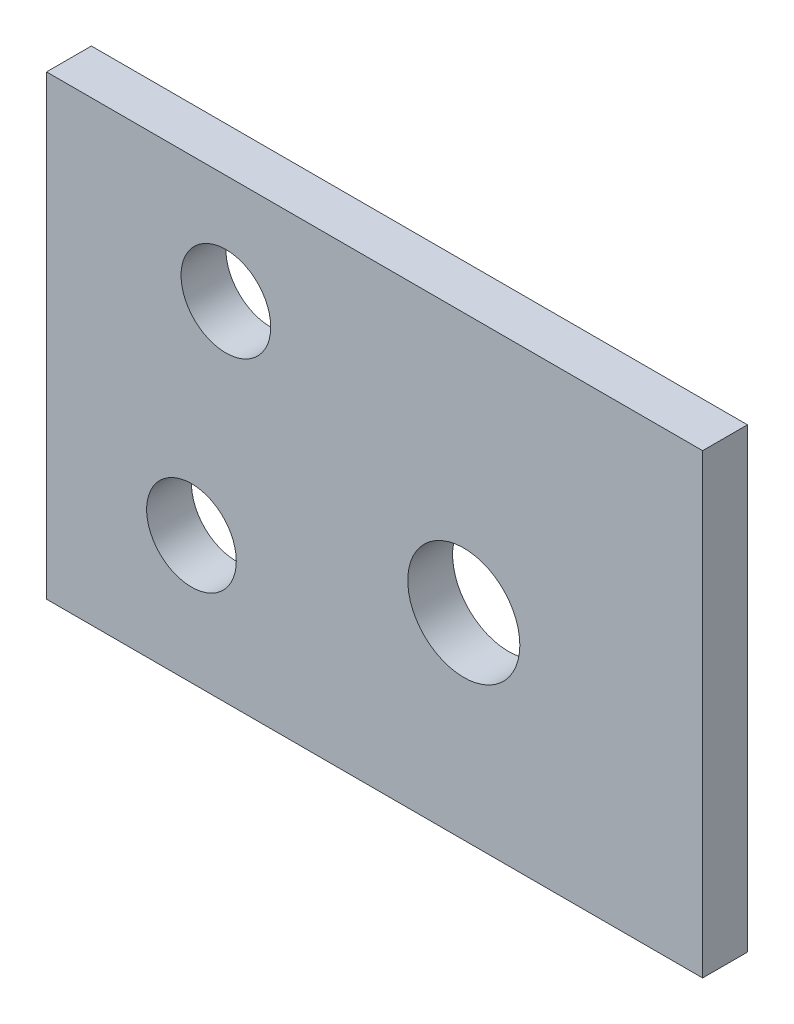
from build123d import *

# Parameters (mm, degrees)
SKETCH_1_W      = 29.26762047
SKETCH_1_H      = 20.372942069
SKETCH_1_R      = 2
SKETCH_1_R_2    = 2.5
EXTRUDE_1_DEPTH = 2


with BuildPart() as part:
    # 스케치1 → 보스-돌출1 (new body)
    with BuildSketch(Plane.XY):
        with Locations((14.633810235, 10.186471035)):
            Rectangle(SKETCH_1_W, SKETCH_1_H)
        with Locations((8, 15.513341209)):
            Circle(SKETCH_1_R, mode=Mode.SUBTRACT)
        with Locations((6.464877971, 5.700685625)):
            Circle(SKETCH_1_R, mode=Mode.SUBTRACT)
        with Locations((18.613880122, 8.784663094)):
            Circle(SKETCH_1_R_2, mode=Mode.SUBTRACT)
    extrude(amount=EXTRUDE_1_DEPTH)


solid = part.part
